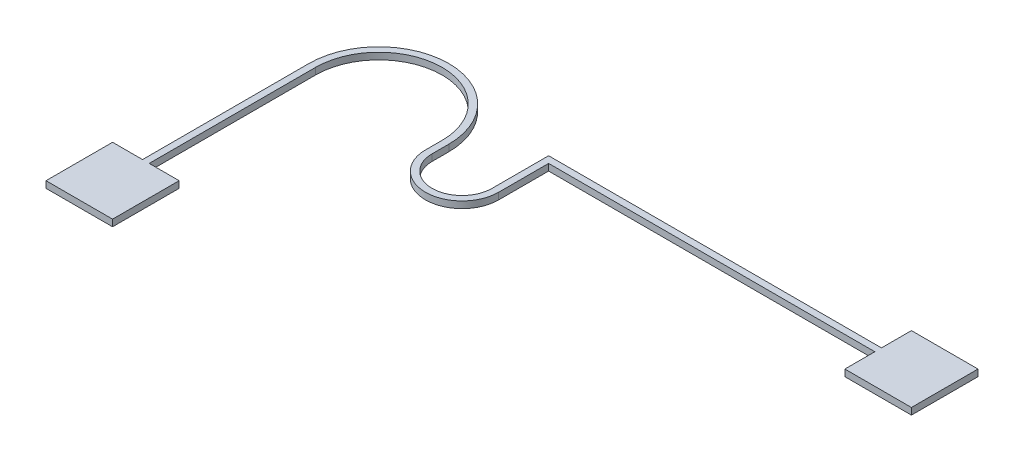
from build123d import *

# Parameters (mm, degrees)
SKETCH1_W           = 200
SKETCH1_H           = 200
SKETCH1_W_2         = 20
SKETCH1_H_2         = 500
SKETCH1_H_3         = 50
SKETCH1_H_4         = 100
BOSS_EXTRUDE1_DEPTH = 20


with BuildPart() as part:
    # Sketch1 → Boss-Extrude1 (new body)
    with BuildSketch(Plane(origin=(0, 0, 0), x_dir=(1, 0, 0), z_dir=(0, 1, 0))):
        Rectangle(SKETCH1_W, SKETCH1_H)
        with Locations((0, 350)):
            Rectangle(SKETCH1_W_2, SKETCH1_H_2)
        with BuildLine():
            Line((-10, 600), (10, 600))
            ThreePointArc((10, 600), (200, 790), (390, 600))
            Line((390, 600), (410, 600))
            ThreePointArc((410, 600), (200, 810), (-10, 600))
        make_face()
        with Locations((400, 575)):
            Rectangle(SKETCH1_W_2, SKETCH1_H_3)
        with BuildLine():
            Line((390, 550), (410, 550))
            ThreePointArc((410, 550), (500, 460), (590, 550))
            Line((590, 550), (610, 550))
            ThreePointArc((610, 550), (500, 440), (390, 550))
        make_face()
        with Locations((600, 575)):
            Rectangle(SKETCH1_W_2, SKETCH1_H_3)
        with Locations((600, 650)):
            Rectangle(SKETCH1_W_2, SKETCH1_H_4)
        Polygon((590, 720), (590, 700), (610, 700), (1590, 700), (1590, 720), align=None)
        Polygon((1590, 720), (1590, 700), (1590, 610), (1790, 610), (1790, 810), (1590, 810), align=None)
    extrude(amount=BOSS_EXTRUDE1_DEPTH)


solid = part.part
